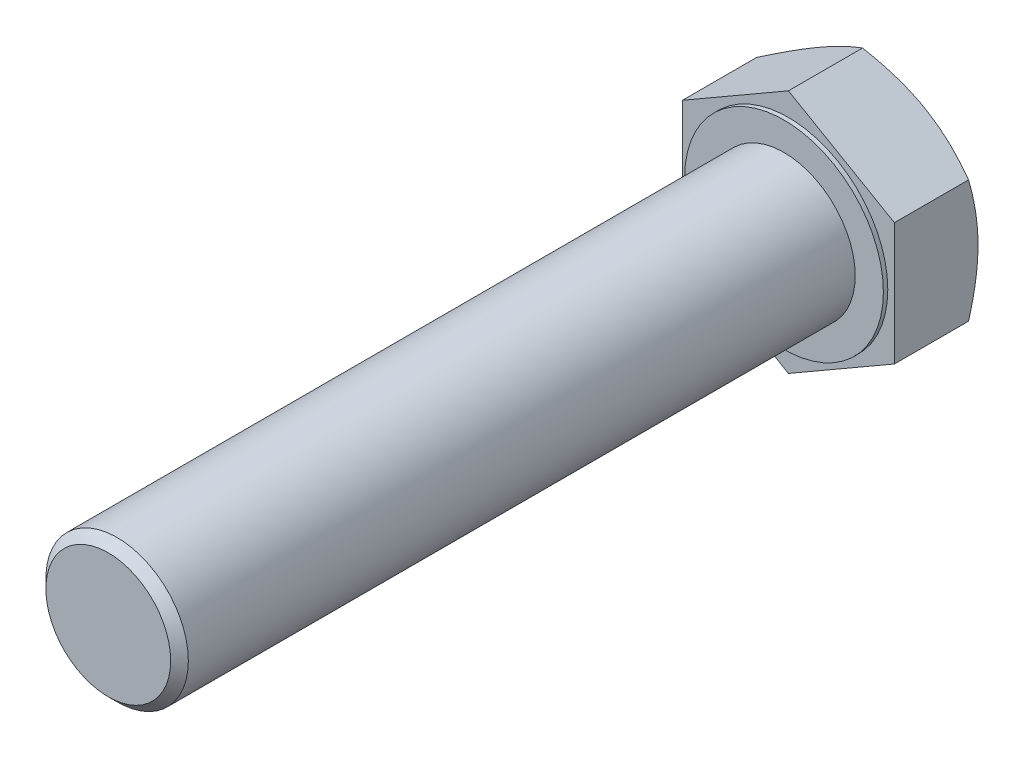
from build123d import *

# Parameters (mm, degrees)
SALIENTE_EXTRUIR1_DEPTH = 10
CROQUIS2_R              = 8.0635
SALIENTE_EXTRUIR2_DEPTH = 77
CROQUIS8_R              = 11.25
SALIENTE_EXTRUIR3_DEPTH = 0.5
CHAFL_N1_SIZE           = 1


with BuildPart() as part:
    # Croquis1 → Saliente-Extruir1 (new body)
    with BuildSketch(Plane.XY):
        Polygon((0, 13.856406461), (-12, 6.92820323), (-12, -6.92820323), (0, -13.856406461), (12, -6.92820323), (12, 6.92820323), align=None)
    extrude(amount=SALIENTE_EXTRUIR1_DEPTH)

    # Croquis2 → Saliente-Extruir2 (add)
    with BuildSketch(Plane.XY.offset(10)):
        Circle(CROQUIS2_R)
    extrude(amount=SALIENTE_EXTRUIR2_DEPTH)

    # Croquis7 → Cortar-Revolución1 (revolve, cut)
    with BuildSketch(Plane(origin=(0, 0, 0), x_dir=(0, 0, -1), z_dir=(1, 0, 0)), mode=Mode.PRIVATE) as cortar_revoluci_n1_sk:
        Polygon((-3.49549265, 17.122750007), (0.466312036, 10.260703002), (0.466312036, 17.122750007), align=None)
    revolve(cortar_revoluci_n1_sk.sketch.rotate(Axis((0, 0, 3.49549265), (0, 0, -1)), 90), axis=Axis((0, 0, 3.49549265), (0, 0, -1)), mode=Mode.SUBTRACT)

    # Croquis8 → Saliente-Extruir3 (add)
    with BuildSketch(Plane.XY.offset(10)):
        Circle(CROQUIS8_R)
    extrude(amount=SALIENTE_EXTRUIR3_DEPTH)

    # Chaflán1
    chafl_n1_edges = [part.edges().sort_by_distance(p)[0] for p in [
        (-8.0635, 0, 87),
    ]]
    chamfer(chafl_n1_edges, length=CHAFL_N1_SIZE)


solid = part.part
